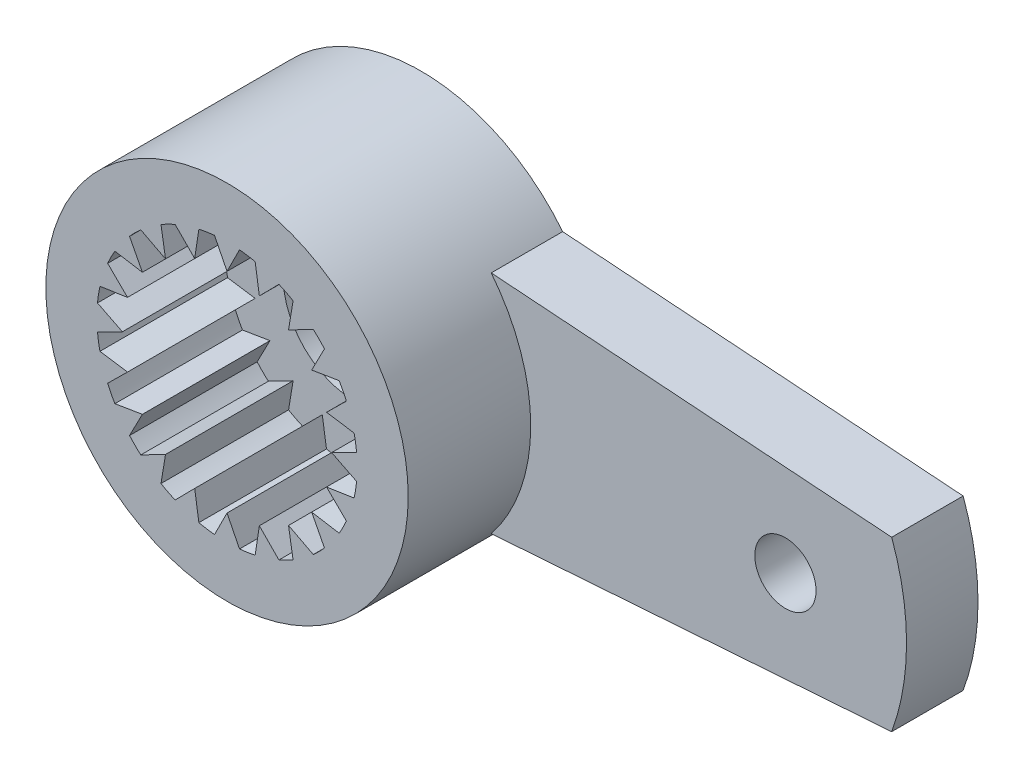
from build123d import *

# Parameters (mm, degrees)
SKETCH2_R           = 3.55
BOSS_EXTRUDE1_DEPTH = 3.8
BOSS_EXTRUDE2_DEPTH = 1.4
SKETCH5_R           = 2.549999919
CUT_EXTRUDE1_DEPTH  = 2.5
BOSS_EXTRUDE3_DEPTH = 2.5
SKETCH6_R           = 1.4
CUT_EXTRUDE2_DEPTH  = 12.745554295
SKETCH7_R           = 0.6
CUT_EXTRUDE3_DEPTH  = 12.724676785


with BuildPart() as part:
    # Sketch2 → Boss-Extrude1 (new body)
    with BuildSketch(Plane.XY):
        Circle(SKETCH2_R)
    extrude(amount=-BOSS_EXTRUDE1_DEPTH)

    # Sketch4 → Boss-Extrude2 (add)
    with BuildSketch(Plane.XY.offset(-2.4)):
        with BuildLine():
            Line((2.776387215, 2.212277889), (10.622617722, 1.649999976))
            ThreePointArc((10.622617722, 1.649999976), (10.913548722, 0), (10.622617722, -1.649999976))
            Line((10.622617722, -1.649999976), (2.776387215, -2.212277889))
            ThreePointArc((2.776387215, -2.212277889), (3.549999952, 0), (2.776387215, 2.212277889))
        make_face()
    extrude(amount=-BOSS_EXTRUDE2_DEPTH)

    # Sketch5 → Cut-Extrude1 (cut)
    with BuildSketch(Plane.XY):
        Circle(SKETCH5_R)
    extrude(amount=-CUT_EXTRUDE1_DEPTH, mode=Mode.SUBTRACT)

    # Sketch3 → Boss-Extrude3 (add)
    with BuildSketch(Plane.XY):
        with BuildLine():
            Line((-0.244697916, 2.538232164), (0, 2.049999952))
            Line((0, 2.049999952), (0.244697916, 2.538232164))
            ThreePointArc((0.244697916, 2.538232164), (0, 2.549999919), (-0.244697916, 2.538232164))
        make_face()
        with BuildLine():
            Line((0.551635326, 2.489618054), (0.633484824, 1.949665813))
            Line((0.633484824, 1.949665813), (1.017078422, 2.338386424))
            ThreePointArc((1.017078422, 2.338386424), (0.787993311, 2.42519404), (0.551635326, 2.489618054))
        make_face()
        with BuildLine():
            Line((1.29397066, 2.197302783), (1.204959739, 1.6584848))
            Line((1.204959739, 1.6584848), (1.689900206, 1.90964313))
            ThreePointArc((1.689900206, 1.90964313), (1.498852346, 2.06299327), (1.29397066, 2.197302783))
        make_face()
        with BuildLine():
            Line((1.90964313, 1.689900206), (1.6584848, 1.204959739))
            Line((1.6584848, 1.204959739), (2.197302783, 1.29397066))
            ThreePointArc((2.197302783, 1.29397066), (2.06299327, 1.498852346), (1.90964313, 1.689900206))
        make_face()
        with BuildLine():
            Line((2.338386424, 1.017078422), (1.949665813, 0.633484824))
            Line((1.949665813, 0.633484824), (2.489618054, 0.551635326))
            ThreePointArc((2.489618054, 0.551635326), (2.42519404, 0.787993311), (2.338386424, 1.017078422))
        make_face()
        with BuildLine():
            Line((2.538232164, 0.244697916), (2.049999952, 0))
            Line((2.049999952, 0), (2.538232164, -0.244697916))
            ThreePointArc((2.538232164, -0.244697916), (2.549999919, 0), (2.538232164, 0.244697916))
        make_face()
        with BuildLine():
            Line((2.489618054, -0.551635326), (1.949665813, -0.633484824))
            Line((1.949665813, -0.633484824), (2.338386424, -1.017078422))
            ThreePointArc((2.338386424, -1.017078422), (2.42519404, -0.787993311), (2.489618054, -0.551635326))
        make_face()
        with BuildLine():
            Line((2.197302783, -1.29397066), (1.6584848, -1.204959739))
            Line((1.6584848, -1.204959739), (1.90964313, -1.689900206))
            ThreePointArc((1.90964313, -1.689900206), (2.06299327, -1.498852346), (2.197302783, -1.29397066))
        make_face()
        with BuildLine():
            Line((1.689900206, -1.90964313), (1.204959739, -1.6584848))
            Line((1.204959739, -1.6584848), (1.29397066, -2.197302783))
            ThreePointArc((1.29397066, -2.197302783), (1.498852346, -2.06299327), (1.689900206, -1.90964313))
        make_face()
        with BuildLine():
            Line((1.017078422, -2.338386424), (0.633484824, -1.949665813))
            Line((0.633484824, -1.949665813), (0.551635326, -2.489618054))
            ThreePointArc((0.551635326, -2.489618054), (0.787993311, -2.42519404), (1.017078422, -2.338386424))
        make_face()
        with BuildLine():
            Line((0.244697916, -2.538232164), (0, -2.049999952))
            Line((0, -2.049999952), (-0.244697916, -2.538232164))
            ThreePointArc((-0.244697916, -2.538232164), (0, -2.549999919), (0.244697916, -2.538232164))
        make_face()
        with BuildLine():
            Line((-0.551635326, -2.489618054), (-0.633484824, -1.949665813))
            Line((-0.633484824, -1.949665813), (-1.017078422, -2.338386424))
            ThreePointArc((-1.017078422, -2.338386424), (-0.787993311, -2.42519404), (-0.551635326, -2.489618054))
        make_face()
        with BuildLine():
            Line((-1.29397066, -2.197302783), (-1.204959739, -1.6584848))
            Line((-1.204959739, -1.6584848), (-1.689900206, -1.90964313))
            ThreePointArc((-1.689900206, -1.90964313), (-1.498852346, -2.06299327), (-1.29397066, -2.197302783))
        make_face()
        with BuildLine():
            Line((-1.90964313, -1.689900206), (-1.6584848, -1.204959739))
            Line((-1.6584848, -1.204959739), (-2.197302783, -1.29397066))
            ThreePointArc((-2.197302783, -1.29397066), (-2.06299327, -1.498852346), (-1.90964313, -1.689900206))
        make_face()
        with BuildLine():
            Line((-2.338386424, -1.017078422), (-1.949665813, -0.633484824))
            Line((-1.949665813, -0.633484824), (-2.489618054, -0.551635326))
            ThreePointArc((-2.489618054, -0.551635326), (-2.42519404, -0.787993311), (-2.338386424, -1.017078422))
        make_face()
        with BuildLine():
            Line((-2.538232164, -0.244697916), (-2.049999952, 0))
            Line((-2.049999952, 0), (-2.538232164, 0.244697916))
            ThreePointArc((-2.538232164, 0.244697916), (-2.549999919, 0), (-2.538232164, -0.244697916))
        make_face()
        with BuildLine():
            Line((-2.489618054, 0.551635326), (-1.949665813, 0.633484824))
            Line((-1.949665813, 0.633484824), (-2.338386424, 1.017078422))
            ThreePointArc((-2.338386424, 1.017078422), (-2.42519404, 0.787993311), (-2.489618054, 0.551635326))
        make_face()
        with BuildLine():
            Line((-2.197302783, 1.29397066), (-1.6584848, 1.204959739))
            Line((-1.6584848, 1.204959739), (-1.90964313, 1.689900206))
            ThreePointArc((-1.90964313, 1.689900206), (-2.06299327, 1.498852346), (-2.197302783, 1.29397066))
        make_face()
        with BuildLine():
            Line((-1.689900206, 1.90964313), (-1.204959739, 1.6584848))
            Line((-1.204959739, 1.6584848), (-1.29397066, 2.197302783))
            ThreePointArc((-1.29397066, 2.197302783), (-1.498852346, 2.06299327), (-1.689900206, 1.90964313))
        make_face()
        with BuildLine():
            Line((-1.017078422, 2.338386424), (-0.633484824, 1.949665813))
            Line((-0.633484824, 1.949665813), (-0.551635326, 2.489618054))
            ThreePointArc((-0.551635326, 2.489618054), (-0.787993311, 2.42519404), (-1.017078422, 2.338386424))
        make_face()
    extrude(amount=-BOSS_EXTRUDE3_DEPTH)

    # Sketch6 → Cut-Extrude2 (cut, through all)
    with BuildSketch(Plane.XY.offset(-2.5)):
        Circle(SKETCH6_R)
    extrude(amount=-CUT_EXTRUDE2_DEPTH, mode=Mode.SUBTRACT)

    # Sketch7 → Cut-Extrude3 (cut, through all)
    with BuildSketch(Plane.XY.offset(-2.4)):
        with Locations((8.5405208, 0)):
            Circle(SKETCH7_R)
    extrude(amount=-CUT_EXTRUDE3_DEPTH, mode=Mode.SUBTRACT)


solid = part.part
